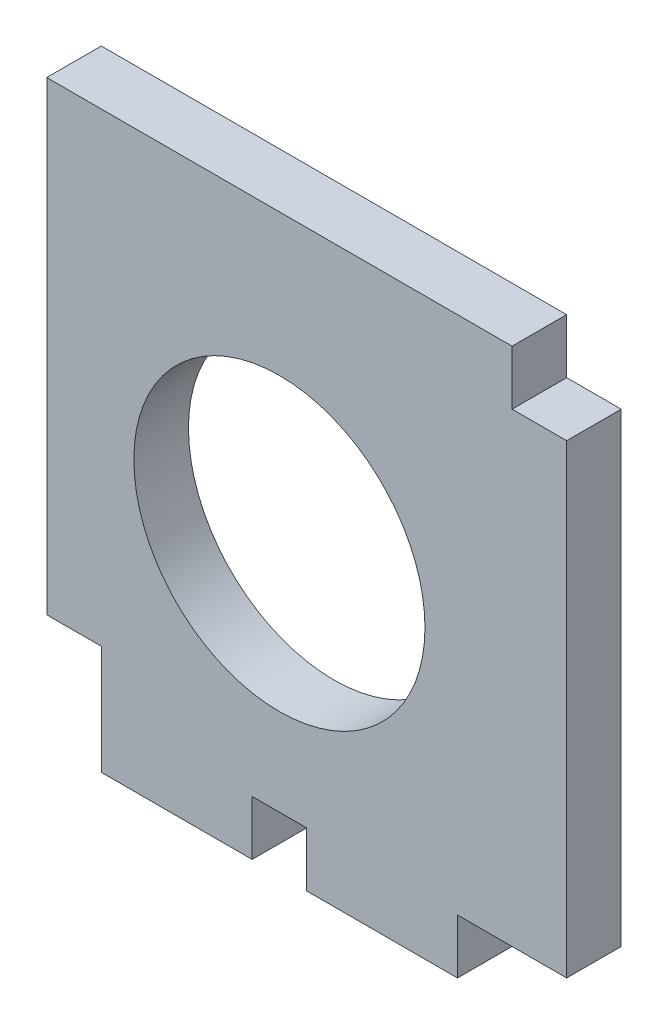
from build123d import *

# Parameters (mm, degrees)
BOSS_EXTRUDE1_DEPTH = 4.7625
SKETCH2_R           = 12.7
CUT_EXTRUDE1_DEPTH  = 36.762259699


with BuildPart() as part:
    # Sketch1 → Boss-Extrude1 (new body)
    with BuildSketch(Plane.XY):
        Polygon((2.38125, -25.0625), (15.5375, -25.0625), (15.5375, -20.3), (25.0625, -20.3), (25.0625, 20.3), (20.3, 20.3), (20.3, 25.0625), (-20.3, 25.0625), (-20.3, -15.5375), (-15.5375, -15.5375), (-15.5375, -25.0625), (-2.38125, -25.0625), (-2.38125, -20.3), (2.38125, -20.3), align=None)
    extrude(amount=BOSS_EXTRUDE1_DEPTH)

    # Sketch2 → Cut-Extrude1 (cut, through all)
    with BuildSketch(Plane.XY.offset(4.7625)):
        Circle(SKETCH2_R)
    extrude(amount=-CUT_EXTRUDE1_DEPTH, mode=Mode.SUBTRACT)


solid = part.part
